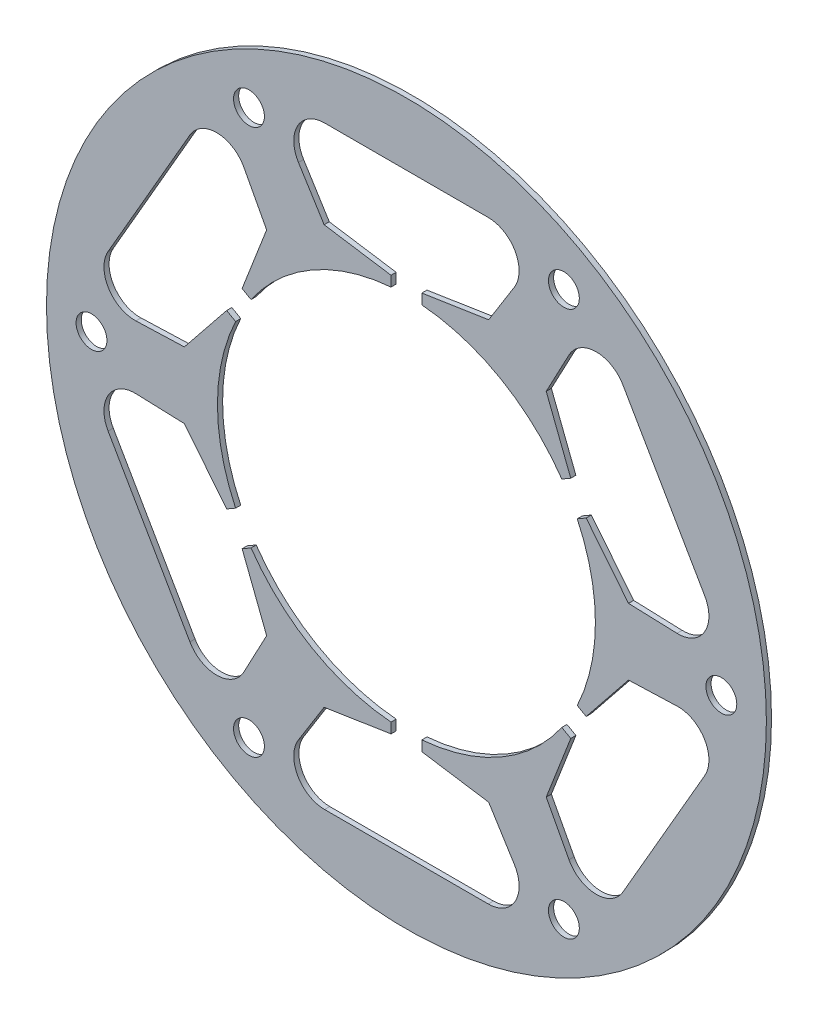
from build123d import *

# Parameters (mm, degrees)
IZIM1_R                     = 35
IZIM1_R_2                   = 1.5
Y_KSEKLIK_EKSTR_ZYON1_DEPTH = 0.5


with BuildPart() as part:
    # Çizim1 → Yükseklik-Ekstrüzyon1 (new body)
    with BuildSketch(Plane.XY):
        Circle(IZIM1_R)
        with Locations((-15.31013221, 26.517926858)):
            Circle(IZIM1_R_2, mode=Mode.SUBTRACT)
        with Locations((15.31013221, 26.517926858)):
            Circle(IZIM1_R_2, mode=Mode.SUBTRACT)
        with Locations((30.62026442, 0)):
            Circle(IZIM1_R_2, mode=Mode.SUBTRACT)
        with Locations((15.31013221, -26.517926858)):
            Circle(IZIM1_R_2, mode=Mode.SUBTRACT)
        with Locations((-15.31013221, -26.517926858)):
            Circle(IZIM1_R_2, mode=Mode.SUBTRACT)
        with Locations((-30.62026442, 0)):
            Circle(IZIM1_R_2, mode=Mode.SUBTRACT)
        with BuildLine():
            Line((-1.5, 18.313673171), (-1.5, 19.313673171))
            Line((-1.5, 19.313673171), (-8, 20.313673171))
            Line((-8, 20.313673171), (-10.5, 24.313673171))
            ThreePointArc((-10.5, 24.313673171), (-10.579932532, 27.357975588), (-7.956005088, 28.903669991))
            Line((-7.956005088, 28.903669991), (7.956005088, 28.903669991))
            ThreePointArc((7.956005088, 28.903669991), (10.579932532, 27.357975588), (10.5, 24.313673171))
            Line((10.5, 24.313673171), (8, 20.313673171))
            Line((8, 20.313673171), (1.5, 19.313673171))
            Line((1.5, 19.313673171), (1.5, 18.313673171))
            ThreePointArc((1.5, 18.313673171), (9.1875, 15.913216795), (15.110106202, 10.455874691))
            Line((15.110106202, 10.455874691), (15.976131606, 10.955874691))
            Line((15.976131606, 10.955874691), (13.59215701, 17.085039816))
            Line((13.59215701, 17.085039816), (15.806258625, 21.250103325))
            ThreePointArc((15.806258625, 21.250103325), (18.402735589, 22.841478137), (21.05330993, 21.341937514))
            Line((21.05330993, 21.341937514), (29.009315018, 7.561732476))
            ThreePointArc((29.009315018, 7.561732476), (28.982668121, 4.516497451), (26.306258625, 3.063569846))
            Line((26.306258625, 3.063569846), (21.59215701, 3.228633355))
            Line((21.59215701, 3.228633355), (17.476131606, 8.35779848))
            Line((17.476131606, 8.35779848), (16.610106202, 7.85779848))
            ThreePointArc((16.610106202, 7.85779848), (18.375, 0), (16.610106202, -7.85779848))
            Line((16.610106202, -7.85779848), (17.476131606, -8.35779848))
            Line((17.476131606, -8.35779848), (21.59215701, -3.228633355))
            Line((21.59215701, -3.228633355), (26.306258625, -3.063569846))
            ThreePointArc((26.306258625, -3.063569846), (28.982668121, -4.516497451), (29.009315018, -7.561732476))
            Line((29.009315018, -7.561732476), (21.05330993, -21.341937514))
            ThreePointArc((21.05330993, -21.341937514), (18.402735589, -22.841478137), (15.806258625, -21.250103325))
            Line((15.806258625, -21.250103325), (13.59215701, -17.085039816))
            Line((13.59215701, -17.085039816), (15.976131606, -10.955874691))
            Line((15.976131606, -10.955874691), (15.110106202, -10.455874691))
            ThreePointArc((15.110106202, -10.455874691), (9.1875, -15.913216795), (1.5, -18.313673171))
            Line((1.5, -18.313673171), (1.5, -19.313673171))
            Line((1.5, -19.313673171), (8, -20.313673171))
            Line((8, -20.313673171), (10.5, -24.313673171))
            ThreePointArc((10.5, -24.313673171), (10.579932532, -27.357975588), (7.956005088, -28.903669991))
            Line((7.956005088, -28.903669991), (-7.956005088, -28.903669991))
            ThreePointArc((-7.956005088, -28.903669991), (-10.579932532, -27.357975588), (-10.5, -24.313673171))
            Line((-10.5, -24.313673171), (-8, -20.313673171))
            Line((-8, -20.313673171), (-1.5, -19.313673171))
            Line((-1.5, -19.313673171), (-1.5, -18.313673171))
            ThreePointArc((-1.5, -18.313673171), (-9.1875, -15.913216795), (-15.110106202, -10.455874691))
            Line((-15.110106202, -10.455874691), (-15.976131606, -10.955874691))
            Line((-15.976131606, -10.955874691), (-13.59215701, -17.085039816))
            Line((-13.59215701, -17.085039816), (-15.806258625, -21.250103325))
            ThreePointArc((-15.806258625, -21.250103325), (-18.402735589, -22.841478137), (-21.05330993, -21.341937514))
            Line((-21.05330993, -21.341937514), (-29.009315018, -7.561732476))
            ThreePointArc((-29.009315018, -7.561732476), (-28.982668121, -4.516497451), (-26.306258625, -3.063569846))
            Line((-26.306258625, -3.063569846), (-21.59215701, -3.228633355))
            Line((-21.59215701, -3.228633355), (-17.476131606, -8.35779848))
            Line((-17.476131606, -8.35779848), (-16.610106202, -7.85779848))
            ThreePointArc((-16.610106202, -7.85779848), (-18.375, 0), (-16.610106202, 7.85779848))
            Line((-16.610106202, 7.85779848), (-17.476131606, 8.35779848))
            Line((-17.476131606, 8.35779848), (-21.59215701, 3.228633355))
            Line((-21.59215701, 3.228633355), (-26.306258625, 3.063569846))
            ThreePointArc((-26.306258625, 3.063569846), (-28.982668121, 4.516497451), (-29.009315018, 7.561732476))
            Line((-29.009315018, 7.561732476), (-21.05330993, 21.341937514))
            ThreePointArc((-21.05330993, 21.341937514), (-18.402735589, 22.841478137), (-15.806258625, 21.250103325))
            Line((-15.806258625, 21.250103325), (-13.59215701, 17.085039816))
            Line((-13.59215701, 17.085039816), (-15.976131606, 10.955874691))
            Line((-15.976131606, 10.955874691), (-15.110106202, 10.455874691))
            ThreePointArc((-15.110106202, 10.455874691), (-9.1875, 15.913216795), (-1.5, 18.313673171))
        make_face(mode=Mode.SUBTRACT)
    extrude(amount=Y_KSEKLIK_EKSTR_ZYON1_DEPTH)


solid = part.part
